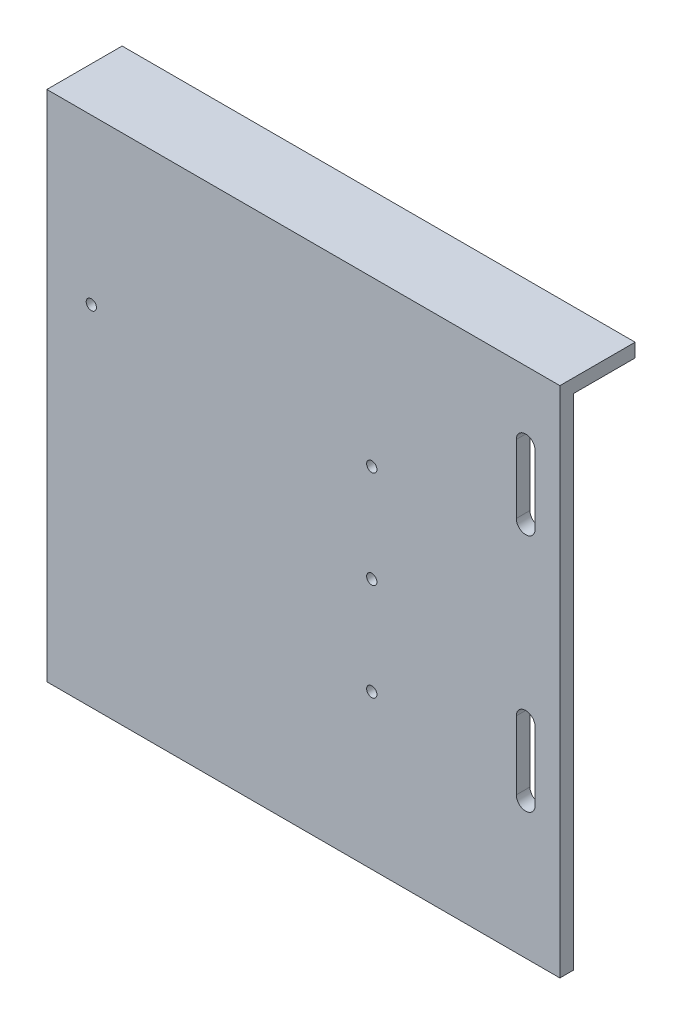
from build123d import *

# Parameters (mm, degrees)
SKETCH_1_W      = 150
SKETCH_1_H      = 150
SKETCH_1_R      = 1.5
EXTRUDE_1_DEPTH = 4
SKETCH_2_W      = 150
SKETCH_2_H      = 4
EXTRUDE_2_DEPTH = 18


with BuildPart() as part:
    # 草图1 → 凸台-拉伸1 (new body)
    with BuildSketch(Plane.XY):
        with Locations((75, 75)):
            Rectangle(SKETCH_1_W, SKETCH_1_H)
        with Locations((95, 102)):
            Circle(SKETCH_1_R, mode=Mode.SUBTRACT)
        with Locations((95, 45)):
            Circle(SKETCH_1_R, mode=Mode.SUBTRACT)
        with Locations((95, 73.5)):
            Circle(SKETCH_1_R, mode=Mode.SUBTRACT)
        with Locations((13, 102)):
            Circle(SKETCH_1_R, mode=Mode.SUBTRACT)
        with BuildLine():
            Line((142.75, 130), (142.75, 110))
            ThreePointArc((142.75, 110), (140, 107.25), (137.25, 110))
            Line((137.25, 110), (137.25, 130))
            ThreePointArc((137.25, 130), (140, 132.75), (142.75, 130))
        make_face(mode=Mode.SUBTRACT)
        with BuildLine():
            Line((142.75, 60), (142.75, 40))
            ThreePointArc((142.75, 40), (140, 37.25), (137.25, 40))
            Line((137.25, 40), (137.25, 60))
            ThreePointArc((137.25, 60), (140, 62.75), (142.75, 60))
        make_face(mode=Mode.SUBTRACT)
    extrude(amount=EXTRUDE_1_DEPTH)

    # 草图2 → 凸台-拉伸2 (add)
    with BuildSketch(Plane(origin=(0, 0, 0), x_dir=(-1, 0, 0), z_dir=(0, 0, -1))):
        with Locations((-75, 148)):
            Rectangle(SKETCH_2_W, SKETCH_2_H)
    extrude(amount=EXTRUDE_2_DEPTH)


solid = part.part
